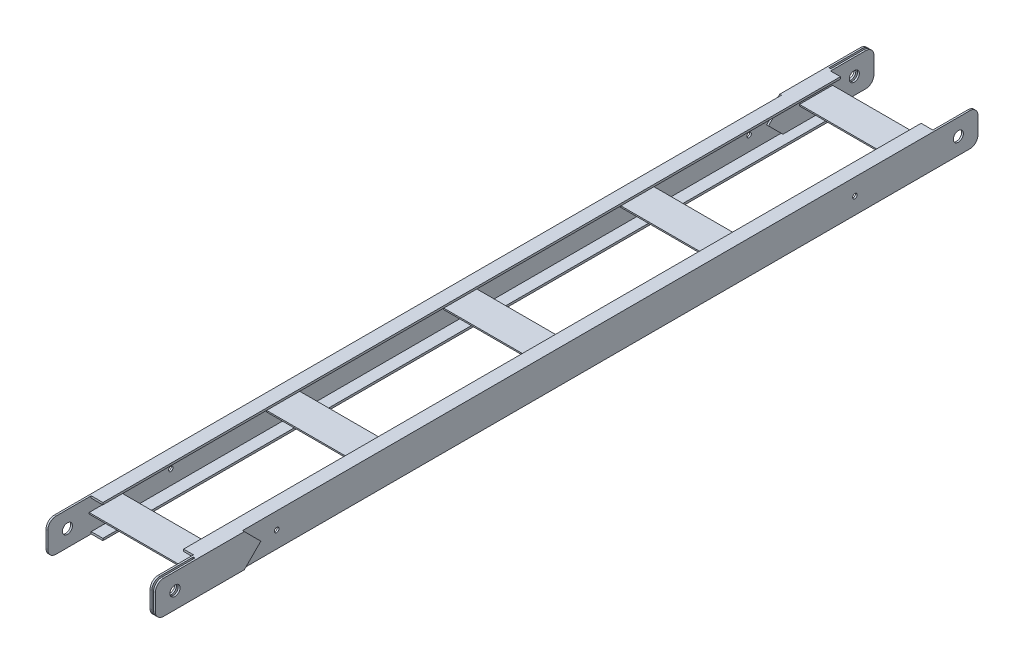
from build123d import *

# Parameters (mm, degrees)
EXTRUDE_1_DEPTH        = 3985
EXTRUDE_1_2_DEPTH      = 3985
EXTRUDE_3_DEPTH        = 520
SKETCH_6_W             = 503
SKETCH_6_H             = 200
CUT_EXTRUDE_4_DEPTH    = 4022.96780196
PATTERN_LINEAR_1_COUNT = 5
PATTERN_LINEAR_1_PITCH = 856.25
EXTRUDE_11_DEPTH       = 8.5
PATTERN_LINEAR_2_COUNT = 2
PATTERN_LINEAR_2_PITCH = 17
SKETCH_22_W            = 8.5
SKETCH_22_H            = 200
CUT_EXTRUDE_12_DEPTH   = 4024.075595859
SKETCH_23_R            = 24.25
CUT_EXTRUDE_13_DEPTH   = 4024.075595859
EXTRUDE_14_DEPTH       = 8.5
PATTERN_LINEAR_3_COUNT = 2
PATTERN_LINEAR_3_PITCH = 17
SKETCH_27_W            = 8.5
SKETCH_27_H            = 200
CUT_EXTRUDE_15_DEPTH   = 4024.075595859
SKETCH_28_R            = 24.25
CUT_EXTRUDE_16_DEPTH   = 4025.201038716
FILLET_2_R             = 40
SKETCH_29_W            = 494.5
SKETCH_29_H            = 10
CUT_EXTRUDE_17_DEPTH   = 10
SKETCH_30_W            = 494.5
SKETCH_30_H            = 10
CUT_EXTRUDE_18_DEPTH   = 10
SKETCH_31_R            = 11
CUT_EXTRUDE_19_DEPTH   = 4024.075595859


with BuildPart() as part:
    # 草图2 → 拉伸1 (new body)
    with BuildSketch(Plane.XY):
        Polygon((0, 0), (0, 160), (65, 160), (65, 150), (8.5, 150), (8.5, 10), (65, 10), (65, 0), align=None)
    extrude(amount=EXTRUDE_1_DEPTH)



with BuildPart() as body_2:
    # 草图2 → Extrude 1 2 (new body)
    with BuildSketch(Plane.XY):
        Polygon((455, 160), (520, 160), (520, 0), (455, 0), (455, 10), (511.5, 10), (511.5, 150), (455, 150), align=None)
    extrude(amount=EXTRUDE_1_2_DEPTH)


with BuildPart() as part_1:
    add(part.part)

    add(body_2.part)  # 拉伸3 merges body 2
    # 草图5 → 拉伸3 (add)
    with BuildSketch(Plane.ZY):
        Polygon((200, 95), (360, 95), (360, 88.5), (283.25, 88.5), (283.25, 48.5), (276.75, 48.5), (276.75, 88.5), (200, 88.5), align=None)
    extrude_3 = extrude(amount=-EXTRUDE_3_DEPTH)

    # 草图6 → 拉伸4 (cut, through all)
    with BuildSketch(Plane(origin=(0, 160, 0), x_dir=(1, 0, 0), z_dir=(0, 1, 0))):
        with Locations((260, -100)):
            Rectangle(SKETCH_6_W, SKETCH_6_H)
        with Locations((260, -3885)):
            Rectangle(SKETCH_6_W, SKETCH_6_H)
    extrude(amount=-CUT_EXTRUDE_4_DEPTH, mode=Mode.SUBTRACT)

    # 阵列(线性)1: 拉伸3 ×5
    with Locations(*[(0, 0, i * PATTERN_LINEAR_1_PITCH) for i in range(1, PATTERN_LINEAR_1_COUNT)]):
        add(extrude_3)

    # 草图19 → 拉伸11 (add)
    with BuildSketch(Plane(origin=(520, 0, 0), x_dir=(0, 0, -1), z_dir=(1, 0, 0))):
        Polygon((-3985, 160), (-3555, 160), (-3475, 80), (-3555, 0), (-3985, 0), align=None)
    extrude_11 = extrude(amount=EXTRUDE_11_DEPTH)

    # 阵列(线性)2: 拉伸11 ×2
    with Locations(*[(-i * PATTERN_LINEAR_2_PITCH, 0, 0) for i in range(1, PATTERN_LINEAR_2_COUNT)]):
        add(extrude_11)

    # 草图22 → 拉伸12 (cut, through all)
    with BuildSketch(Plane(origin=(0, 160, 0), x_dir=(1, 0, 0), z_dir=(0, 1, 0))):
        with Locations((515.75, -3885)):
            Rectangle(SKETCH_22_W, SKETCH_22_H)
    extrude(amount=-CUT_EXTRUDE_12_DEPTH, mode=Mode.SUBTRACT)

    # 草图23 → 拉伸13 (cut, through all)
    with BuildSketch(Plane.ZY):
        with Locations(Location((95, 80, 0), (0, 0, 180))):
            Circle(SKETCH_23_R)
        with Locations(Location((3890, 80, 0), (0, 0, 180))):
            Circle(SKETCH_23_R)
    extrude(amount=-CUT_EXTRUDE_13_DEPTH, mode=Mode.SUBTRACT)

    # 草图26 → 拉伸14 (add)
    with BuildSketch(Plane.ZY):
        Polygon((0, 160), (0, 0), (430, 0), (510, 80), (430, 160), align=None)
    extrude_14 = extrude(amount=EXTRUDE_14_DEPTH)

    # 阵列(线性)3: 拉伸14 ×2
    with Locations(*[(i * PATTERN_LINEAR_3_PITCH, 0, 0) for i in range(1, PATTERN_LINEAR_3_COUNT)]):
        add(extrude_14)

    # 草图27 → 拉伸15 (cut, through all)
    with BuildSketch(Plane(origin=(0, 160, 0), x_dir=(1, 0, 0), z_dir=(0, 1, 0))):
        with Locations((4.25, -100)):
            Rectangle(SKETCH_27_W, SKETCH_27_H)
    extrude(amount=-CUT_EXTRUDE_15_DEPTH, mode=Mode.SUBTRACT)

    # 草图28 → 拉伸16 (cut, through all)
    with BuildSketch(Plane.ZY.offset(8.5)):
        with Locations(Location((95, 80, 0), (0, 0, 180))):
            Circle(SKETCH_28_R)
    extrude(amount=-CUT_EXTRUDE_16_DEPTH, mode=Mode.SUBTRACT)

    # 圆角2
    fillet_2_edges = [part_1.edges().sort_by_distance(p)[0] for p in [
        (-4.25, 0, 0),
        (507.25, 0, 3985),
        (4.25, 160, 3985),
        (4.25, 0, 3985),
        (507.25, 160, 3985),
        (524.25, 0, 3985),
        (-4.25, 160, 0),
        (12.75, 0, 0),
        (515.75, 160, 0),
        (524.25, 160, 3985),
        (515.75, 0, 0),
        (12.75, 160, 0),
    ]]
    fillet(fillet_2_edges, radius=FILLET_2_R)

    # 草图29 → 拉伸17 (cut)
    with BuildSketch(Plane.XY.offset(3785)):
        with Locations((255.75, 155)):
            Rectangle(SKETCH_29_W, SKETCH_29_H)
        with Locations((255.75, 5)):
            Rectangle(SKETCH_29_W, SKETCH_29_H)
    extrude(amount=-CUT_EXTRUDE_17_DEPTH, mode=Mode.SUBTRACT)

    # 草图30 → 拉伸18 (cut)
    with BuildSketch(Plane(origin=(0, 0, 200), x_dir=(-1, 0, 0), z_dir=(0, 0, -1))):
        with Locations((-264.25, 155)):
            Rectangle(SKETCH_30_W, SKETCH_30_H)
        with Locations((-264.25, 5)):
            Rectangle(SKETCH_30_W, SKETCH_30_H)
    extrude(amount=-CUT_EXTRUDE_18_DEPTH, mode=Mode.SUBTRACT)

    # 草图31 → 拉伸19 (cut, through all)
    with BuildSketch(Plane(origin=(520, 0, 0), x_dir=(0, 0, -1), z_dir=(1, 0, 0))):
        with Locations((-595, 80)):
            Circle(SKETCH_31_R)
        with Locations((-3390, 80)):
            Circle(SKETCH_31_R)
    extrude(amount=-CUT_EXTRUDE_19_DEPTH, mode=Mode.SUBTRACT)


solid = part_1.part
